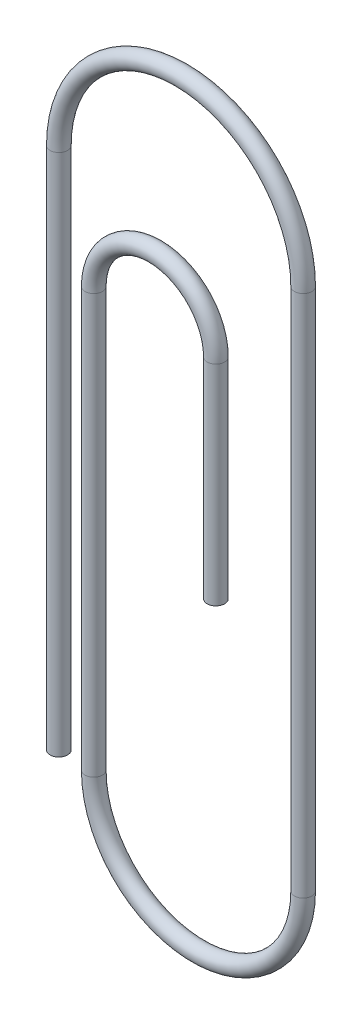
from build123d import *

# Parameters (mm, degrees)
SWEEP2_PROFILE_R = 2.5


with BuildPart() as part:
    # Sweep2: sweep along a path in Sketch2
    with BuildLine(Plane.XY) as sweep2_path:
        Line((-83.615819209, -108.192090395), (-83.615819209, 41.807909605))
        ThreePointArc((-83.615819209, 41.807909605), (-48.615819209, 76.807909605), (-13.615819209, 41.807909605))
        Line((-13.615819209, 41.807909605), (-13.615819209, -108.192090395))
        ThreePointArc((-13.615819209, -108.192090395), (-43.615819209, -138.192090395), (-73.615819209, -108.192090395))
        Line((-73.615819209, -108.192090395), (-73.615819209, 11.807909605))
        ThreePointArc((-73.615819209, 11.807909605), (-56.115819209, 29.307909605), (-38.615819209, 11.807909605))
        Line((-38.615819209, 11.807909605), (-38.615819209, -48.192090395))
    # Sweep2 profile (on start of the path) → Sweep2 (sweep)
    with BuildSketch(Plane(origin=(-83.615819209, -108.192090395, 0), x_dir=(0, 0, 1), z_dir=(0, 1, 0))):
        Circle(SWEEP2_PROFILE_R)
    sweep(path=sweep2_path.line)


solid = part.part
